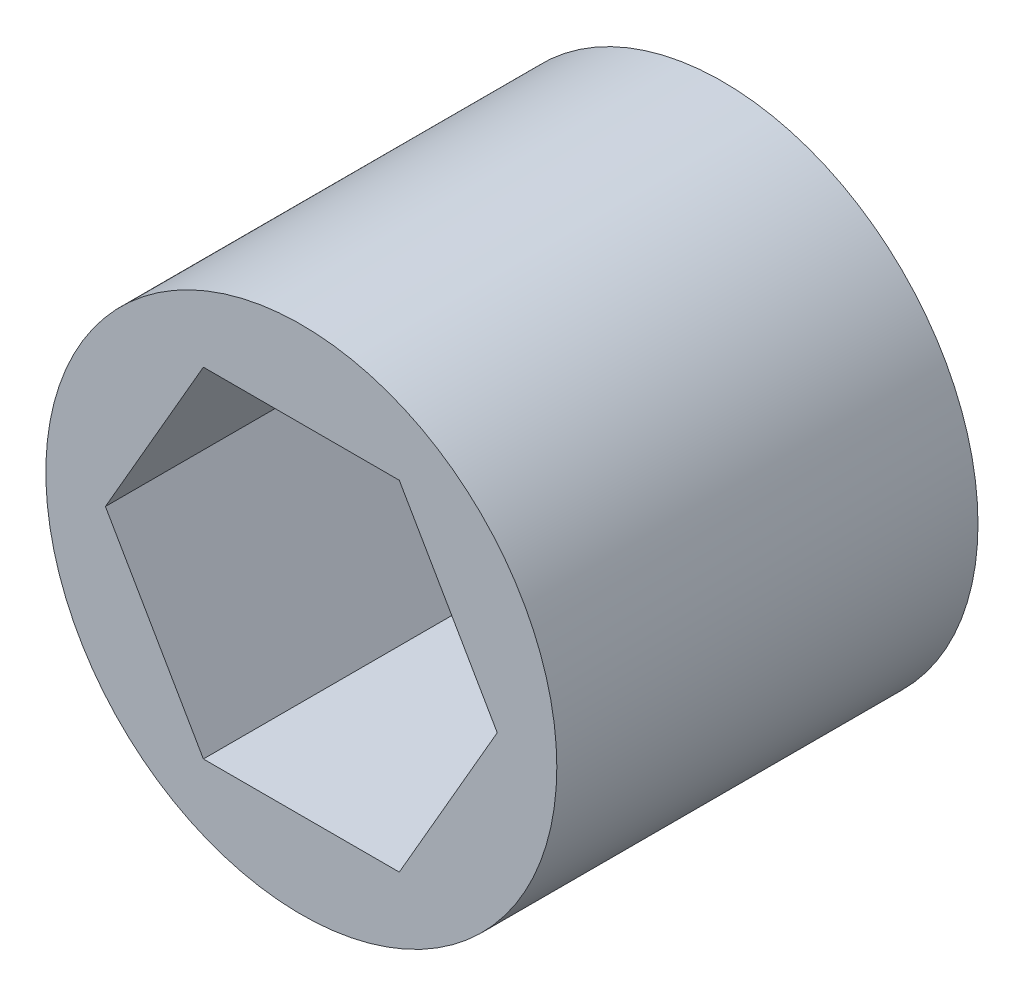
from build123d import *

# Parameters (mm, degrees)
SKETCH2_R           = 9.7536
BOSS_EXTRUDE2_DEPTH = 16.0782


with BuildPart() as part:
    # Sketch2 → Boss-Extrude2 (new body)
    with BuildSketch(Plane.XY):
        Circle(SKETCH2_R)
        Polygon((7.478995387, 0), (3.739497694, 6.477), (-3.739497694, 6.477), (-7.478995387, 0), (-3.739497694, -6.477), (3.739497694, -6.477), align=None, mode=Mode.SUBTRACT)
    extrude(amount=BOSS_EXTRUDE2_DEPTH)


solid = part.part
